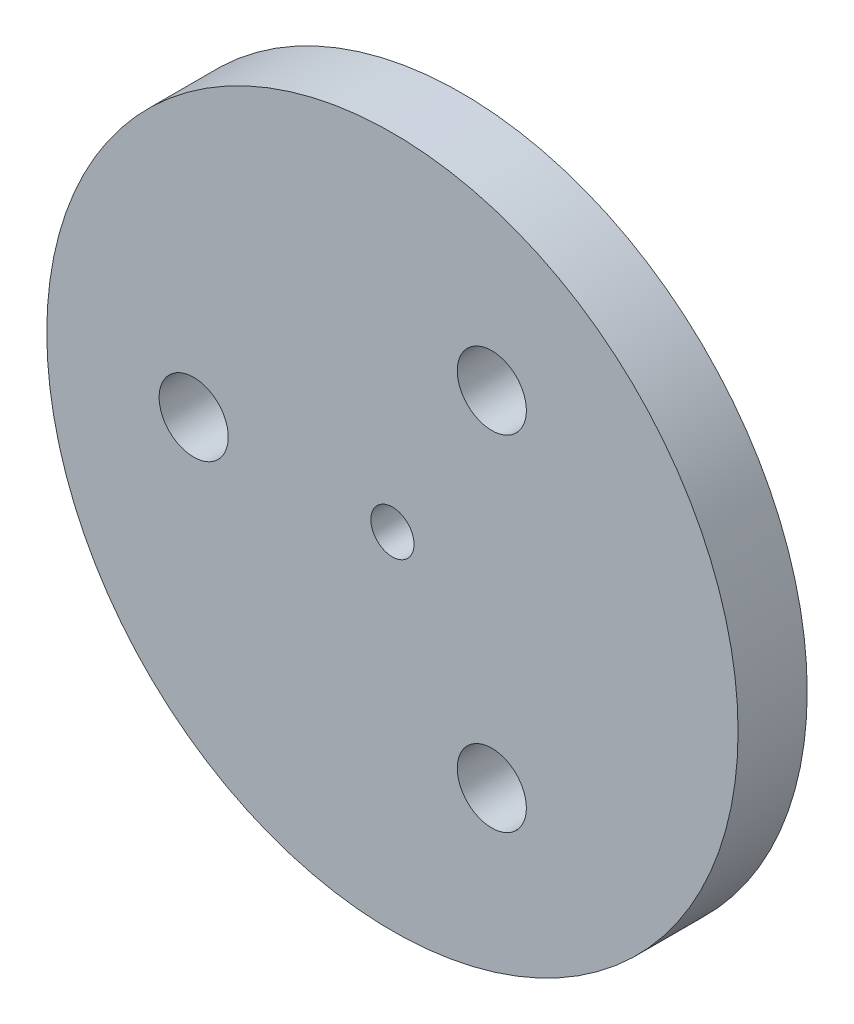
from build123d import *

# Parameters (mm, degrees)
SKIZZE1_R                       = 20
SKIZZE1_R_2                     = 2
AUFSATZ_LINEAR_AUSTRAGEN1_DEPTH = 4
SKIZZE2_R                       = 1.25
SCHNITT_LINEAR_AUSTRAGEN1_DEPTH = 29.565713714


with BuildPart() as part:
    # Skizze1 → Aufsatz-Linear austragen1 (new body)
    with BuildSketch(Plane.XY):
        Circle(SKIZZE1_R)
        with Locations((-11.5, 0)):
            Circle(SKIZZE1_R_2, mode=Mode.SUBTRACT)
        with Locations((5.75, 9.959292144)):
            Circle(SKIZZE1_R_2, mode=Mode.SUBTRACT)
        with Locations((5.75, -9.959292144)):
            Circle(SKIZZE1_R_2, mode=Mode.SUBTRACT)
    extrude(amount=AUFSATZ_LINEAR_AUSTRAGEN1_DEPTH)

    # Skizze2 → Schnitt-Linear austragen1 (cut, through all)
    with BuildSketch(Plane.XY.offset(4)):
        Circle(SKIZZE2_R)
    extrude(amount=-SCHNITT_LINEAR_AUSTRAGEN1_DEPTH, mode=Mode.SUBTRACT)


solid = part.part
